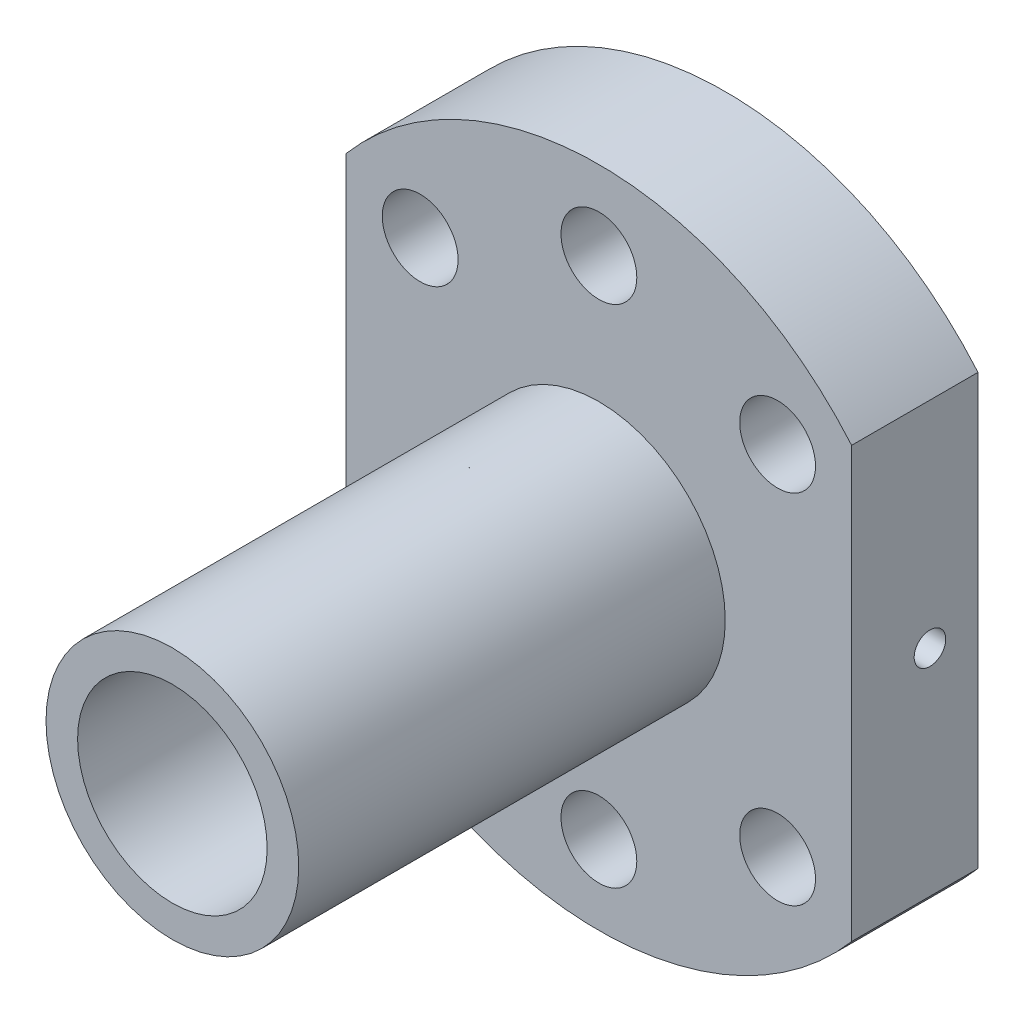
from build123d import *

# Parameters (mm, degrees)
EXTRUDE_1_DEPTH     = 8
SKETCH_3_R          = 8
SKETCH_3_R_2        = 6
EXTRUDE_3_DEPTH     = 27
SKETCH_5_R          = 6
CUT_EXTRUDE_1_DEPTH = 38.762415177
SKETCH_6_R          = 2.4
CUT_EXTRUDE_2_DEPTH = 38.762415177
SKETCH_7_R          = 9
CUT_EXTRUDE_3_DEPTH = 1.5
SKETCH_8_R          = 1
CUT_EXTRUDE_4_DEPTH = 52.86520992


with BuildPart() as part:
    # 草图2 → 凸台-拉伸1 (new body)
    with BuildSketch(Plane.XY):
        with BuildLine():
            Line((-16, 13.601470509), (-16, -13.601470509))
            ThreePointArc((-16, -13.601470509), (0, -21), (16, -13.601470509))
            Line((16, -13.601470509), (16, 13.601470509))
            ThreePointArc((16, 13.601470509), (0, 21), (-16, 13.601470509))
        make_face()
    extrude(amount=EXTRUDE_1_DEPTH)

    # 草图3 → 凸台-拉伸3 (add)
    with BuildSketch(Plane.XY.offset(8)):
        Circle(SKETCH_3_R)
        Circle(SKETCH_3_R_2, mode=Mode.SUBTRACT)
    extrude(amount=EXTRUDE_3_DEPTH)

    # 草图5 → 切除-拉伸1 (cut, through all)
    with BuildSketch(Plane.XY.offset(8)):
        Circle(SKETCH_5_R)
    extrude(amount=-CUT_EXTRUDE_1_DEPTH, mode=Mode.SUBTRACT)

    # 草图6 → 切除-拉伸2 (cut, through all)
    with BuildSketch(Plane.XY.offset(8)):
        with Locations((0, 16)):
            Circle(SKETCH_6_R)
        with Locations((11.313708499, 11.313708499)):
            Circle(SKETCH_6_R)
        with Locations((11.313708499, -11.313708499)):
            Circle(SKETCH_6_R)
        with Locations((0, -16)):
            Circle(SKETCH_6_R)
        with Locations((-11.313708499, -11.313708499)):
            Circle(SKETCH_6_R)
        with Locations((-11.313708499, 11.313708499)):
            Circle(SKETCH_6_R)
    extrude(amount=-CUT_EXTRUDE_2_DEPTH, mode=Mode.SUBTRACT)

    # 草图7 → 切除-拉伸3 (cut)
    with BuildSketch(Plane(origin=(0, 0, 0), x_dir=(-1, 0, 0), z_dir=(0, 0, -1))):
        Circle(SKETCH_7_R)
    extrude(amount=-CUT_EXTRUDE_3_DEPTH, mode=Mode.SUBTRACT)

    # 草图8 → 切除-拉伸4 (cut, through all)
    with BuildSketch(Plane.ZY.offset(16)):
        with Locations(Location((3.040852045, 0, 0), (0, 0, 270))):
            Circle(SKETCH_8_R)
    extrude(amount=-CUT_EXTRUDE_4_DEPTH, mode=Mode.SUBTRACT)


solid = part.part
